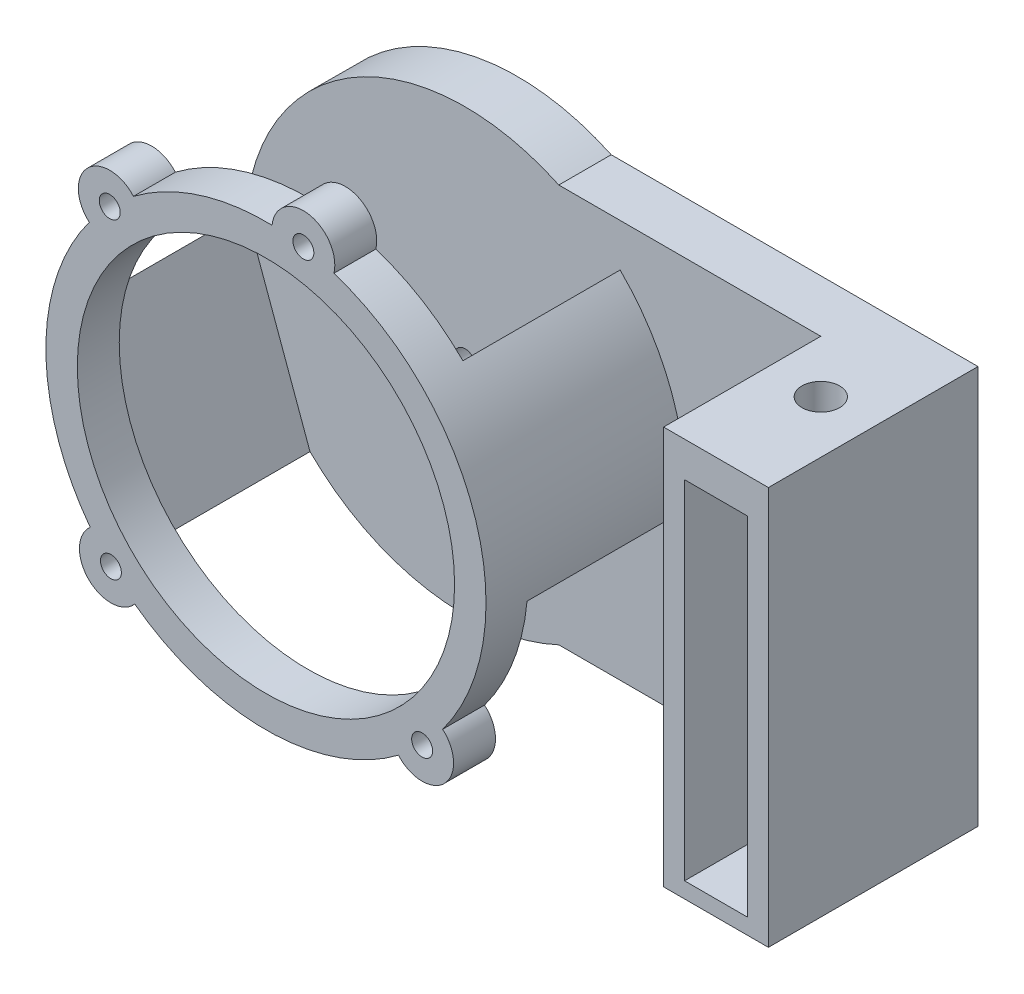
from build123d import *

# Parameters (mm, degrees)
ESTRUSIONE_ESTRUSIONE1_DEPTH = 2.5
SCHIZZO2_W                   = 10
SCHIZZO2_H                   = 38
ESTRUSIONE_ESTRUSIONE2_DEPTH = 15
SCHIZZO3_W                   = 6
SCHIZZO3_H                   = 33.15
TAGLIO_ESTRUSIONE1_DEPTH     = 20
ESTRUSIONE_SOTTILE1_START    = 19
SCHIZZO5_R                   = 21
SCHIZZO5_R_2                 = 18
ESTRUSIONE_SOTTILE1_DEPTH    = 19
SCHIZZO8_W                   = 38
SCHIZZO8_H                   = 15
TAGLIO_ESTRUSIONE2_DEPTH     = 70.157520353
SCHIZZO10_R                  = 3
ESTRUSIONE_ESTRUSIONE3_DEPTH = 4
FORO_PER_VITE_M1_6_1_D       = 2
FORO_PER_VITE_M1_6_1_DEPTH   = 3
FORO_PER_VITE_M1_6_1_TIP     = 0.600860619
SCHIZZO12_R                  = 1
TAGLIO_ESTRUSIONE3_DEPTH     = 3
FORO_PER_VITE_M3_1_D         = 3.6
FORO_PER_VITE_M3_1_DEPTH     = 4
FORO_PER_VITE_M3_1_TIP       = 1.081549114


with BuildPart() as part:
    # Schizzo1 → Estrusione-Estrusione1 (new, symmetric)
    with BuildSketch(Plane.XY):
        with BuildLine():
            Line((12.36549987, -26.390648792), (47.36549987, -26.390648792))
            Line((47.36549987, -26.390648792), (47.36549987, 11.609351208))
            Line((47.36549987, 11.609351208), (12.36549987, 11.609351208))
            ThreePointArc((12.36549987, 11.609351208), (-17.57877204, -7.390648792), (12.36549987, -26.390648792))
        make_face()
    extrude(amount=ESTRUSIONE_ESTRUSIONE1_DEPTH, both=True)

    # Schizzo2 → Estrusione-Estrusione2 (add)
    with BuildSketch(Plane.XY.offset(2.5)):
        with Locations((42.36549987, -7.390648792)):
            Rectangle(SCHIZZO2_W, SCHIZZO2_H)
    extrude(amount=ESTRUSIONE_ESTRUSIONE2_DEPTH)

    # Schizzo3 → Taglio-Estrusione1 (cut)
    with BuildSketch(Plane.XY.offset(17.5)):
        with Locations((42.36549987, -8.315648792)):
            Rectangle(SCHIZZO3_W, SCHIZZO3_H)
    extrude(amount=-TAGLIO_ESTRUSIONE1_DEPTH, mode=Mode.SUBTRACT)

    # Schizzo5 → Estrusione-Sottile1 (add)
    with BuildSketch(Plane.XY.offset(2.5).offset(ESTRUSIONE_SOTTILE1_START)):
        with Locations((3.42122796, -7.390648792)):
            Circle(SCHIZZO5_R)
        with Locations((3.42122796, -7.390648792)):
            Circle(SCHIZZO5_R_2, mode=Mode.SUBTRACT)
    extrude(amount=-ESTRUSIONE_SOTTILE1_DEPTH)

    # Schizzo8 → Taglio-Estrusione2 (cut, through all)
    with BuildSketch(Plane(origin=(-4.406906628, 12.10787645, 0), x_dir=(0.9396926207859102, 0.3420201433256638, 0), z_dir=(-0.3420201433256638, 0.9396926207859102, 0))):
        with Locations((0.687151909, -10)):
            Rectangle(SCHIZZO8_W, SCHIZZO8_H)
    extrude(amount=-TAGLIO_ESTRUSIONE2_DEPTH, mode=Mode.SUBTRACT)

    # Schizzo10 → Estrusione-Estrusione3 (add)
    with BuildSketch(Plane.XY.offset(21.5)):
        with Locations((-11.482021075, 7.404389842)):
            Circle(SCHIZZO10_R)
        with Locations((18.324476995, -22.185687427)):
            Circle(SCHIZZO10_R)
        with Locations((-11.373810674, -22.293897828)):
            Circle(SCHIZZO10_R)
        with Locations((6.992461631, 13.303463657)):
            Circle(SCHIZZO10_R)
    extrude(amount=-ESTRUSIONE_ESTRUSIONE3_DEPTH)

    # Foro per Vite M1.6-1
    with Locations(Plane(origin=(6.992461631, 13.303463657, 21.5), x_dir=(1, 0, 0), z_dir=(0, 0, 1))):
        with Locations((0, 0), (-18.474482706, -5.899073815), (-18.366272305, -35.597361485), (11.332015364, -35.489151084)):
            Hole(FORO_PER_VITE_M1_6_1_D / 2, depth=FORO_PER_VITE_M1_6_1_DEPTH)
            with Locations((0, 0, -(FORO_PER_VITE_M1_6_1_DEPTH + FORO_PER_VITE_M1_6_1_TIP / 2))):  # 118° drill point
                Cone(0, FORO_PER_VITE_M1_6_1_D / 2, FORO_PER_VITE_M1_6_1_TIP, mode=Mode.SUBTRACT)

    # Schizzo12 → Taglio-Estrusione3 (cut)
    with BuildSketch(Plane.XY.offset(2.5)):
        with Locations((3.42122796, -7.390648792)):
            Circle(SCHIZZO12_R)
    extrude(amount=-TAGLIO_ESTRUSIONE3_DEPTH, mode=Mode.SUBTRACT)

    # Foro per Vite M3-1
    with Locations(Plane(origin=(42.36549987, 11.609351208, 7.5), x_dir=(1, 0, 0), z_dir=(0, 1, 0))):
        with Locations((0, 0)):
            Hole(FORO_PER_VITE_M3_1_D / 2, depth=FORO_PER_VITE_M3_1_DEPTH)
            with Locations((0, 0, -(FORO_PER_VITE_M3_1_DEPTH + FORO_PER_VITE_M3_1_TIP / 2))):  # 118° drill point
                Cone(0, FORO_PER_VITE_M3_1_D / 2, FORO_PER_VITE_M3_1_TIP, mode=Mode.SUBTRACT)


solid = part.part
